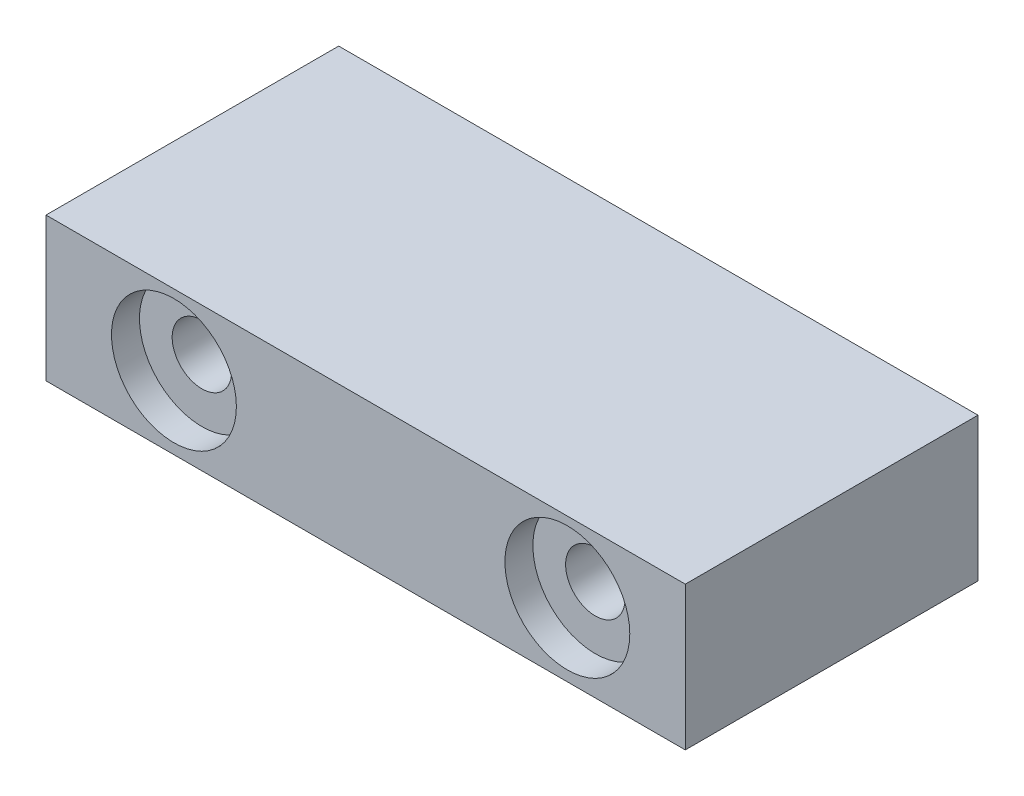
from build123d import *

# Parameters (mm, degrees)
SKETCH1_W                                           = 16.25
SKETCH1_H                                           = 3.65
BOSS_EXTRUDE1_DEPTH                                 = 7.44
CBORE_FOR_00_BINDING_HEAD_MACHINE_SCREW_D           = 1.5113
CBORE_FOR_00_BINDING_HEAD_MACHINE_SCREW_DEPTH       = 5
CBORE_FOR_00_BINDING_HEAD_MACHINE_SCREW_CBORE_D     = 3.175
CBORE_FOR_00_BINDING_HEAD_MACHINE_SCREW_CBORE_DEPTH = 0.7112
CBORE_FOR_00_BINDING_HEAD_MACHINE_SCREW_TIP         = 0.454040327


with BuildPart() as part:
    # Sketch1 → Boss-Extrude1 (new body)
    with BuildSketch(Plane.XY):
        with Locations((0, 1.825)):
            Rectangle(SKETCH1_W, SKETCH1_H)
    extrude(amount=BOSS_EXTRUDE1_DEPTH)

    # CBORE for #00 Binding Head Machine Screw1
    with Locations(Plane.XY.offset(7.44)):
        with Locations((-4.873259483, 1.85), (5.126740517, 1.85)):
            CounterBoreHole(CBORE_FOR_00_BINDING_HEAD_MACHINE_SCREW_D / 2, CBORE_FOR_00_BINDING_HEAD_MACHINE_SCREW_CBORE_D / 2, CBORE_FOR_00_BINDING_HEAD_MACHINE_SCREW_CBORE_DEPTH, depth=CBORE_FOR_00_BINDING_HEAD_MACHINE_SCREW_DEPTH)
            with Locations((0, 0, -(CBORE_FOR_00_BINDING_HEAD_MACHINE_SCREW_DEPTH + CBORE_FOR_00_BINDING_HEAD_MACHINE_SCREW_TIP / 2))):  # 118° drill point
                Cone(0, CBORE_FOR_00_BINDING_HEAD_MACHINE_SCREW_D / 2, CBORE_FOR_00_BINDING_HEAD_MACHINE_SCREW_TIP, mode=Mode.SUBTRACT)


solid = part.part
